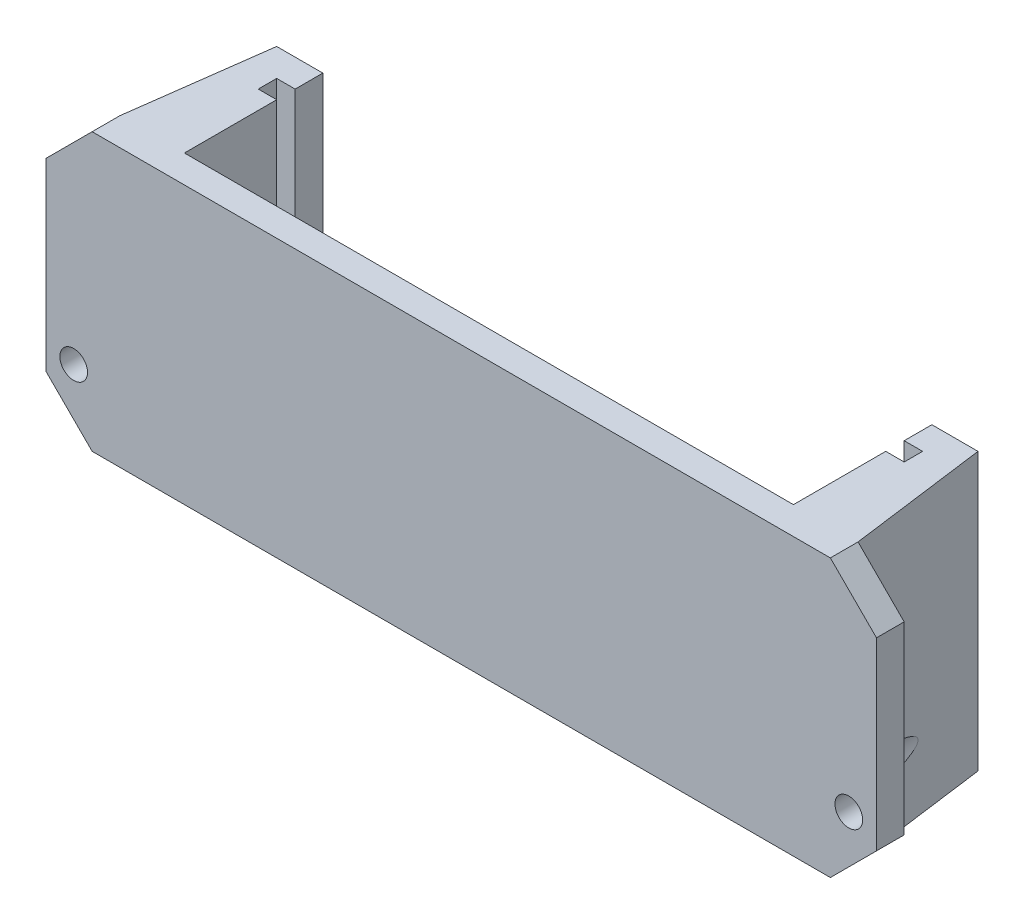
from build123d import *

# Parameters (mm, degrees)
BOSS_EXTRUDE1_DEPTH = 30
SKETCH2_R           = 1.5
CUT_EXTRUDE1_DEPTH  = 20
CUT_EXTRUDE2_START  = 20
SKETCH2_3_R         = 3
SKETCH2_3_R_2       = 1.5
CUT_EXTRUDE2_DEPTH  = 20
CHAMFER1_SIZE       = 5


with BuildPart() as part:
    # Sketch1 → Boss-Extrude1 (new body)
    with BuildSketch(Plane(origin=(0, 0, 0), x_dir=(1, 0, 0), z_dir=(0, 1, 0))):
        Polygon((-3, 11.892818554), (-5, -3.107181446), (-10, -3.107181446), (-10, -6.107181446), (80, -6.107181446), (80, -3.107181446), (75, -3.107181446), (73, 11.892818554), (68, 11.892818554), (68, 8.892818554), (70, 8.892818554), (70, 6.892818554), (68, 6.892818554), (68, -3.107181446), (2, -3.107181446), (2, 6.892818554), (0, 6.892818554), (0, 8.892818554), (2, 8.892818554), (2, 11.892818554), align=None)
    extrude(amount=BOSS_EXTRUDE1_DEPTH)

    # Sketch2 → Cut-Extrude1 (cut)
    with BuildSketch(Plane(origin=(0, 0, 3.107181446), x_dir=(-1, 0, 0), z_dir=(0, 0, -1))):
        with Locations((7, 7.154704287)):
            Circle(SKETCH2_R)
        with Locations((-77, 7.154704287)):
            Circle(SKETCH2_R)
    extrude(amount=-CUT_EXTRUDE1_DEPTH, mode=Mode.SUBTRACT)

    # Sketch2<3> → Cut-Extrude2 (cut)
    # profile 1 of 2: a face of its own
    with BuildSketch(Plane(origin=(0, 0, 3.107181446), x_dir=(-1, 0, 0), z_dir=(0, 0, -1)).offset(CUT_EXTRUDE2_START)):
        with Locations((7, 7.154704287)):
            Circle(SKETCH2_3_R)
        with Locations((7, 7.154704287)):
            Circle(SKETCH2_3_R_2, mode=Mode.SUBTRACT)
    # profile 2 of 2: a face of its own
    with BuildSketch(Plane(origin=(0, 0, 3.107181446), x_dir=(-1, 0, 0), z_dir=(0, 0, -1)).offset(CUT_EXTRUDE2_START)):
        with Locations((-77, 7.154704287)):
            Circle(SKETCH2_3_R)
        with Locations((-77, 7.154704287)):
            Circle(SKETCH2_3_R_2, mode=Mode.SUBTRACT)
    extrude(amount=-CUT_EXTRUDE2_DEPTH, mode=Mode.SUBTRACT)

    # Chamfer1
    chamfer1_edges = [part.edges().sort_by_distance(p)[0] for p in [
        (80, 0, 4.607181446),
        (80, 30, 4.607181446),
        (-10, 0, 4.607181446),
        (-10, 30, 4.607181446),
    ]]
    chamfer(chamfer1_edges, length=CHAMFER1_SIZE)


solid = part.part
